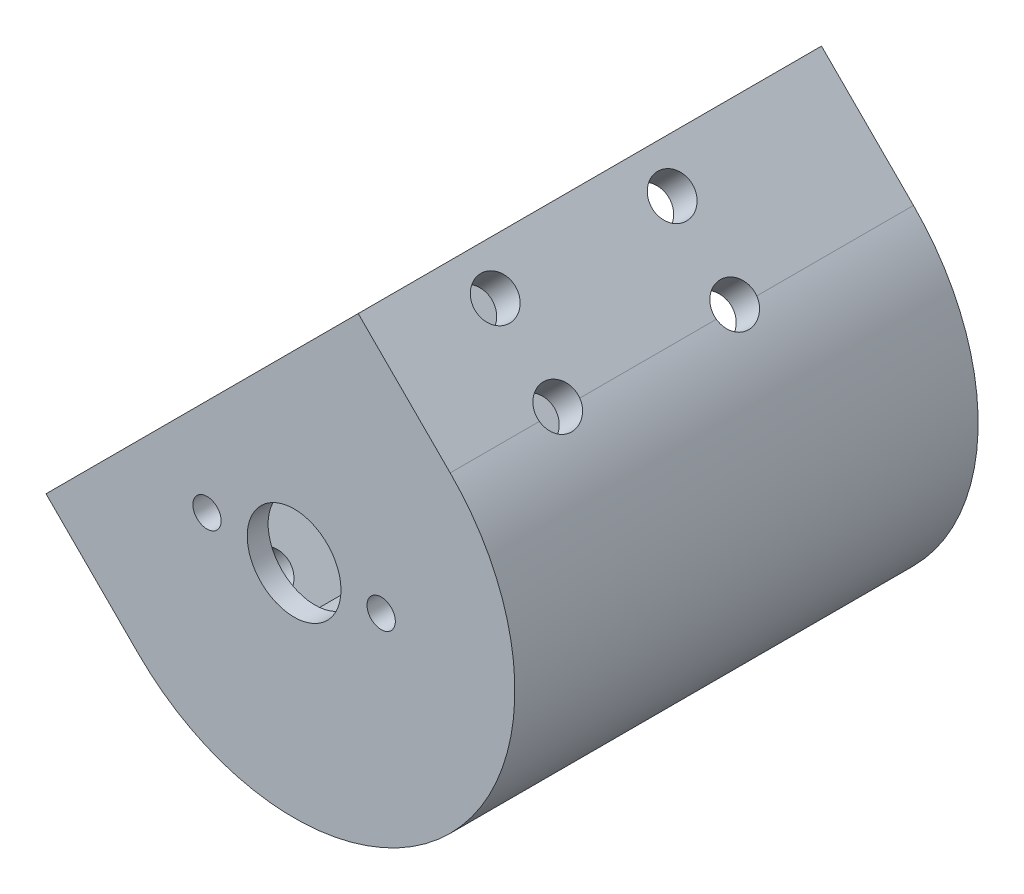
from build123d import *

# Parameters (mm, degrees)
BOSS_EXTRUDE1_DEPTH = 63.5
BOSS_EXTRUDE2_START = 3
SKETCH4_R           = 6.731
SKETCH4_R_2         = 2.0309967
BOSS_EXTRUDE2_DEPTH = 3
SKETCH5_R           = 2.921
CUT_EXTRUDE3_DEPTH  = 102.608265033


with BuildPart() as part:
    # Sketch2 → Boss-Extrude1 (new body)
    with BuildSketch(Plane.XY):
        with BuildLine():
            Line((5.832216731, 32.244069222), (9.199812777, 35.611665268))
            Line((9.199812777, 35.611665268), (22.405739022, 22.405739022))
            ThreePointArc((22.405739022, 22.405739022), (22.405739022, -22.405739022), (-22.405739022, -22.405739022))
            Line((-22.405739022, -22.405739022), (-35.611665268, -9.199812777))
            Line((-35.611665268, -9.199812777), (-32.244069222, -5.832216731))
            Line((-32.244069222, -5.832216731), (-15.361187714, -22.715098239))
            Line((-15.361187714, -22.715098239), (-10.21301234, -17.566922865))
            ThreePointArc((-10.21301234, -17.566922865), (14.368409794, -14.368409794), (17.566922865, 10.21301234))
            Line((17.566922865, 10.21301234), (22.715098239, 15.361187714))
            Line((22.715098239, 15.361187714), (5.832216731, 32.244069222))
        make_face()
    extrude(amount=-BOSS_EXTRUDE1_DEPTH)

    # Sketch4 → Boss-Extrude2 (add)
    with BuildSketch(Plane.XY.offset(BOSS_EXTRUDE2_START)):
        with BuildLine():
            Line((9.199812777, 35.611665268), (-35.611665268, -9.199812777))
            Line((-35.611665268, -9.199812777), (-22.405739022, -22.405739022))
            ThreePointArc((-22.405739022, -22.405739022), (22.405739022, -22.405739022), (22.405739022, 22.405739022))
            Line((22.405739022, 22.405739022), (9.199812777, 35.611665268))
        make_face()
        Circle(SKETCH4_R, mode=Mode.SUBTRACT)
        with Locations((12.5, 0)):
            Circle(SKETCH4_R_2, mode=Mode.SUBTRACT)
        with Locations((-12.5, 0)):
            Circle(SKETCH4_R_2, mode=Mode.SUBTRACT)
    extrude(amount=-BOSS_EXTRUDE2_DEPTH)

    # Sketch5 → Cut-Extrude3 (cut, through all)
    with BuildSketch(Plane(origin=(-22.405739022, -22.405739022, 0), x_dir=(0, 0, 1), z_dir=(-0.7071067811865476, -0.7071067811865476, 0))):
        with Locations(Location((-12.7, 0.3626, 0), (0, 0, 352.869161209))):
            Circle(SKETCH5_R)
        with Locations(Location((-12.7, 13.0626, 0), (0, 0, 270))):
            Circle(SKETCH5_R)
        with Locations(Location((-38.1, 13.0626, 0), (0, 0, 270))):
            Circle(SKETCH5_R)
        with Locations(Location((-38.1, 0.3626, 0), (0, 0, 352.869161209))):
            Circle(SKETCH5_R)
    extrude(amount=-CUT_EXTRUDE3_DEPTH, mode=Mode.SUBTRACT)


solid = part.part
